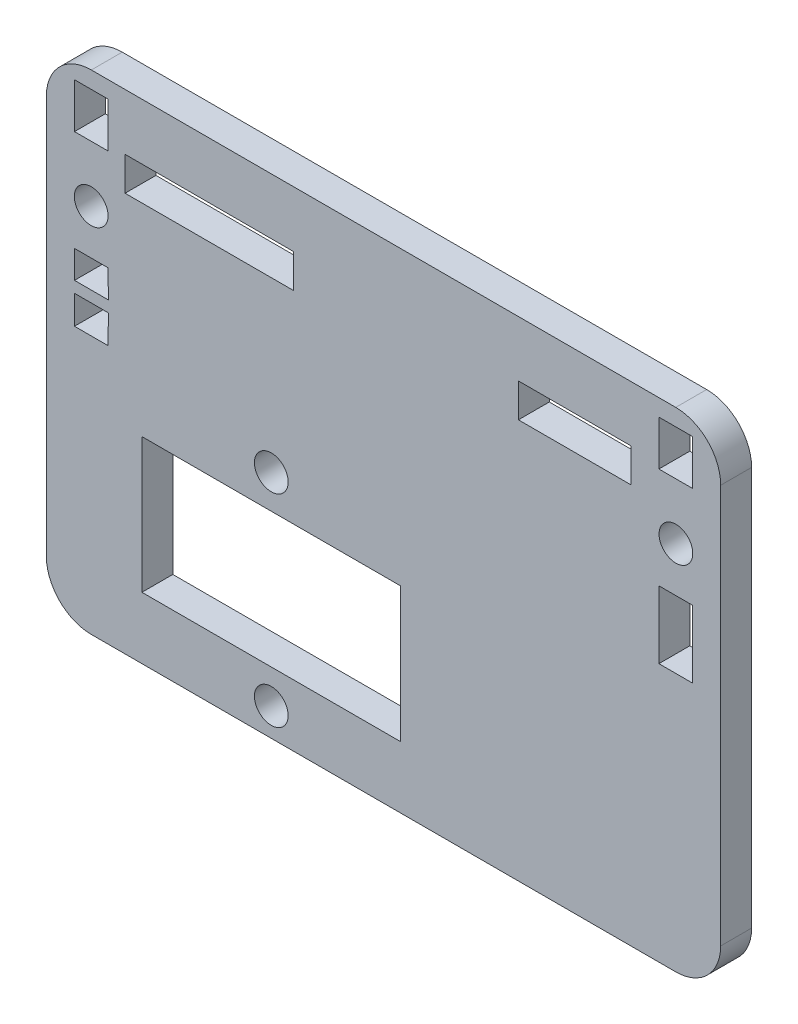
from build123d import *

# Parameters (mm, degrees)
SKETCH1_W           = 60
SKETCH1_H           = 43.5
SKETCH1_R           = 1.5
SKETCH1_W_2         = 23
SKETCH1_H_2         = 12
SKETCH1_W_3         = 15
SKETCH1_H_3         = 3
SKETCH1_W_4         = 10
SKETCH1_W_5         = 3
SKETCH1_H_4         = 6
SKETCH1_H_5         = 4
BOSS_EXTRUDE1_DEPTH = 2.75
FILLET1_R           = 4


with BuildPart() as part:
    # Sketch1 → Boss-Extrude1 (new body)
    with BuildSketch(Plane.XY):
        with Locations((-7.382405678, -3.098084383)):
            Rectangle(SKETCH1_W, SKETCH1_H)
        with Locations((-17.369283231, -22.348084383)):
            Circle(SKETCH1_R, mode=Mode.SUBTRACT)
        with Locations((-17.369283231, -4.348084383)):
            Circle(SKETCH1_R, mode=Mode.SUBTRACT)
        with Locations((18.630716769, 8.151915617)):
            Circle(SKETCH1_R, mode=Mode.SUBTRACT)
        with Locations(Location((-33.395528126, 8.151915617, 0), (0, 0, 180))):
            Circle(SKETCH1_R, mode=Mode.SUBTRACT)
        with Locations((-17.382405678, -13.348084383)):
            Rectangle(SKETCH1_W_2, SKETCH1_H_2, mode=Mode.SUBTRACT)
        with Locations((-22.882405678, 12.151915617)):
            Rectangle(SKETCH1_W_3, SKETCH1_H_3, mode=Mode.SUBTRACT)
        with Locations((9.617594322, 12.191282959)):
            Rectangle(SKETCH1_W_4, SKETCH1_H_3, mode=Mode.SUBTRACT)
        with Locations((18.617594322, 1.151915617)):
            Rectangle(SKETCH1_W_5, SKETCH1_H_4, mode=Mode.SUBTRACT)
        with Locations((18.617594322, 15.151915617)):
            Rectangle(SKETCH1_W_5, SKETCH1_H_5, mode=Mode.SUBTRACT)
        Polygon((-31.882405678, 4.151915617), (-34.882405678, 4.151915617), (-34.882405678, 1.688906326), (-31.8745626, 1.688906326), align=None, mode=Mode.SUBTRACT)
        Polygon((-34.882405678, -1.848084383), (-34.882405678, 0.693659593), (-31.8745626, 0.693659593), (-31.882405678, -1.848084383), align=None, mode=Mode.SUBTRACT)
        with Locations((-33.382405678, 15.151915617)):
            Rectangle(SKETCH1_W_5, SKETCH1_H_5, mode=Mode.SUBTRACT)
    extrude(amount=BOSS_EXTRUDE1_DEPTH)

    # Fillet1
    fillet1_edges = [part.edges().sort_by_distance(p)[0] for p in [
        (22.617594322, -24.848084383, 1.375),
        (-37.382405678, -24.848084383, 1.375),
        (-37.382405678, 18.651915617, 1.375),
        (22.617594322, 18.651915617, 1.375),
    ]]
    fillet(fillet1_edges, radius=FILLET1_R)


solid = part.part
